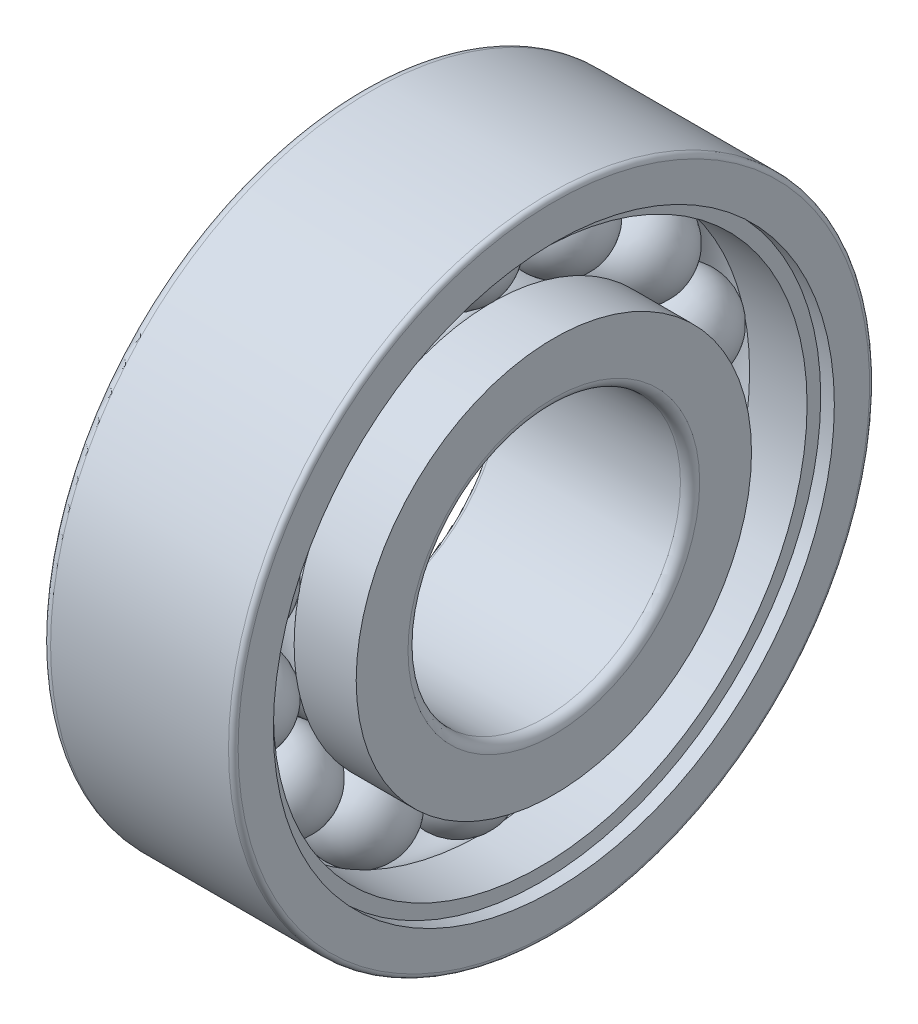
from build123d import *

# Parameters (mm, degrees)
CIRCULAR_PATTERN1_COUNT = 14
FILLET1_R               = 0.6
FILLET2_R               = 0.3


with BuildPart() as part:
    # Sketch1 → Revolve1 (revolve)
    with BuildSketch(Plane.XY):
        with BuildLine():
            Line((-2.875, 14.25), (2.875, 14.25))
            ThreePointArc((2.875, 14.25), (0, 11.375), (-2.875, 14.25))
        make_face()
    revolve1 = revolve(axis=Axis((-3.091912561, 14.25, 0), (1, 0, 0)))

    # Sketch2 → Revolve2 (revolve)
    with BuildSketch(Plane.XY, mode=Mode.PRIVATE) as revolve2_sk:
        with BuildLine():
            Line((-6, 12.333333333), (-2.129463287, 12.333333333))
            ThreePointArc((-2.129463287, 12.333333333), (0, 11.385), (2.129463287, 12.333333333))
            Line((2.129463287, 12.333333333), (6, 12.333333333))
            Line((6, 12.333333333), (6, 8.5))
            Line((6, 8.5), (-6, 8.5))
            Line((-6, 8.5), (-6, 12.333333333))
        make_face()
    revolve(revolve2_sk.sketch.rotate(Axis((-2.992358943, 0, 0), (1, 0, 0)), 90), axis=Axis((-2.992358943, 0, 0), (1, 0, 0)))

    # Sketch3 → Revolve3 (revolve)
    with BuildSketch(Plane.XY, mode=Mode.PRIVATE) as revolve3_sk:
        with BuildLine():
            Line((-6, 16.166666667), (-6, 20))
            Line((-6, 20), (6, 20))
            Line((6, 20), (6, 17.501666667))
            Line((6, 17.501666667), (5.15, 17.501666667))
            Line((5.15, 17.501666667), (5.15, 16.651666667))
            Line((5.15, 16.651666667), (1.562121065, 16.651666667))
            ThreePointArc((1.562121065, 16.651666667), (-0.373196395, 17.090589631), (-2.129463287, 16.166666667))
            Line((-2.129463287, 16.166666667), (-6, 16.166666667))
        make_face()
    revolve(revolve3_sk.sketch.rotate(Axis((-2.992358943, 0, 0), (1, 0, 0)), 90), axis=Axis((-2.992358943, 0, 0), (1, 0, 0)))

    # Circular-Pattern1: Revolve1 ×14 about axis
    circular_pattern1_axis = Axis((0, 0, 0), (1, 0, 0))
    for i in range(1, CIRCULAR_PATTERN1_COUNT):
        add(revolve1.rotate(circular_pattern1_axis, i * 360 / CIRCULAR_PATTERN1_COUNT))

    # Fillet1
    fillet1_edges = [part.edges().sort_by_distance(p)[0] for p in [
        (-6, 0, -20),
        (6, 0, -8.5),
    ]]
    fillet(fillet1_edges, radius=FILLET1_R)

    # Fillet2
    fillet2_edges = [part.edges().sort_by_distance(p)[0] for p in [
        (6, 0, -20),
        (-6, 0, -8.5),
    ]]
    fillet(fillet2_edges, radius=FILLET2_R)


solid = part.part
